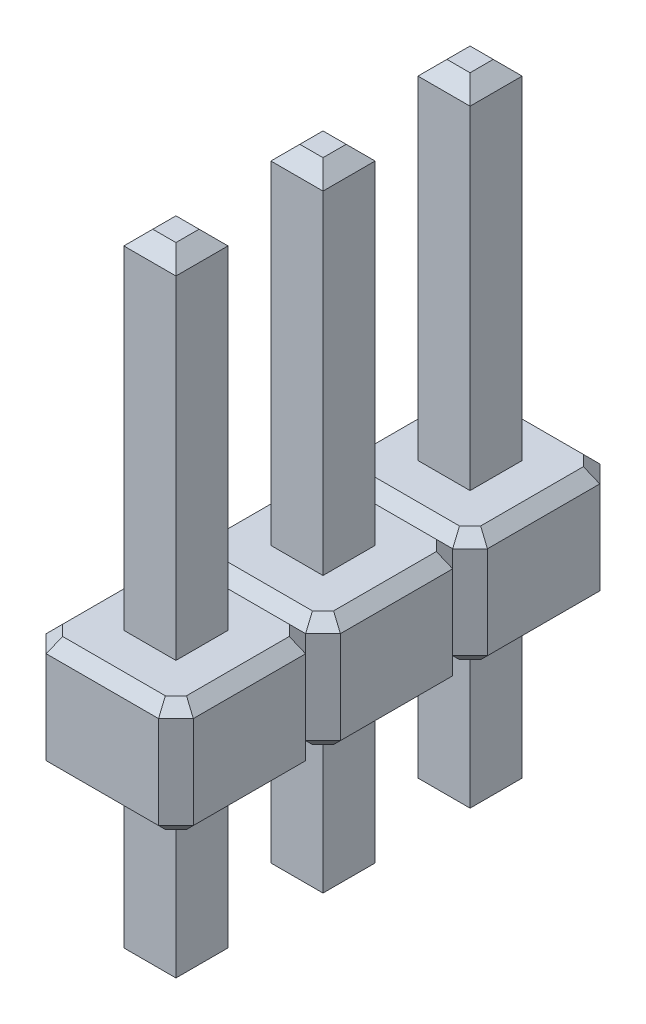
from build123d import *

# Parameters (mm, degrees)
SKETCH_1_W             = 0.9
SKETCH_1_H             = 0.9
METAL_PART_DEPTH       = 11
PLASTIC_START          = 3
PLASTIC_PART_DEPTH     = 2
CHAMFER_1_SIZE         = 0.2
CHAMFER_2_SIZE         = 0.25
PATTERN_LINEAR_1_COUNT = 3
PATTERN_LINEAR_1_PITCH = 2.54


with BuildPart() as part:
    # Эскиз1 → metal part (new body)
    with BuildSketch(Plane(origin=(0, 0, 0), x_dir=(1, 0, 0), z_dir=(0, 1, 0))):
        Rectangle(SKETCH_1_W, SKETCH_1_H)
    extrude(amount=METAL_PART_DEPTH)

    # Фаска2
    chamfer_2_edges = [part.edges().sort_by_distance(p)[0] for p in [
        (0, 0, 0.45),
        (0.45, 0, 0),
        (0, 0, -0.45),
        (-0.45, 0, 0),
        (0.45, 11, 0),
        (0, 11, -0.45),
        (0, 11, 0.45),
        (-0.45, 11, 0),
    ]]
    chamfer(chamfer_2_edges, length=CHAMFER_2_SIZE)


with BuildPart() as body_2:
    # Эскиз1<3> → plastic part (new body)
    with BuildSketch(Plane(origin=(0, 0, 0), x_dir=(1, 0, 0), z_dir=(0, 1, 0)).offset(PLASTIC_START)):
        Polygon((-0.97, -1.27), (0.97, -1.27), (1.27, -0.97), (1.27, 0.97), (0.97, 1.27), (-0.97, 1.27), (-1.27, 0.97), (-1.27, -0.97), align=None)
    extrude(amount=PLASTIC_PART_DEPTH)

    # Фаска1
    chamfer_1_edges = [body_2.edges().sort_by_distance(p)[0] for p in [
        (1.12, 3, -1.12),
        (1.27, 3, 0),
        (1.12, 3, 1.12),
        (0, 3, 1.27),
        (-1.12, 3, 1.12),
        (-1.27, 3, 0),
        (-1.12, 3, -1.12),
        (0, 3, -1.27),
        (1.12, 5, -1.12),
        (0, 5, -1.27),
        (-1.12, 5, -1.12),
        (-1.27, 5, 0),
        (-1.12, 5, 1.12),
        (1.27, 5, 0),
        (1.12, 5, 1.12),
        (0, 5, 1.27),
    ]]
    chamfer(chamfer_1_edges, length=CHAMFER_1_SIZE)


with BuildPart() as pattern_linear_1_1:
    # Линейный массив1: pattern copy
    add(part.part.moved(Location(Vector(0, 0, -1) * (1 * PATTERN_LINEAR_1_PITCH))))


with BuildPart() as pattern_linear_1_2:
    # Линейный массив1: pattern copy
    add(part.part.moved(Location(Vector(0, 0, -1) * (2 * PATTERN_LINEAR_1_PITCH))))


with BuildPart() as pattern_linear_1_3:
    # Линейный массив1: pattern copy
    add(body_2.part.moved(Location(Vector(0, 0, -1) * (1 * PATTERN_LINEAR_1_PITCH))))


with BuildPart() as pattern_linear_1_4:
    # Линейный массив1: pattern copy
    add(body_2.part.moved(Location(Vector(0, 0, -1) * (2 * PATTERN_LINEAR_1_PITCH))))


with BuildPart() as pattern_linear_1_3_1:
    add(pattern_linear_1_3.part)

    # Combine 2: union Линейный массив1_4, body 2
    add(pattern_linear_1_4.part)
    add(body_2.part)


solid = Compound([part.part, pattern_linear_1_1.part, pattern_linear_1_2.part, pattern_linear_1_3_1.part])
